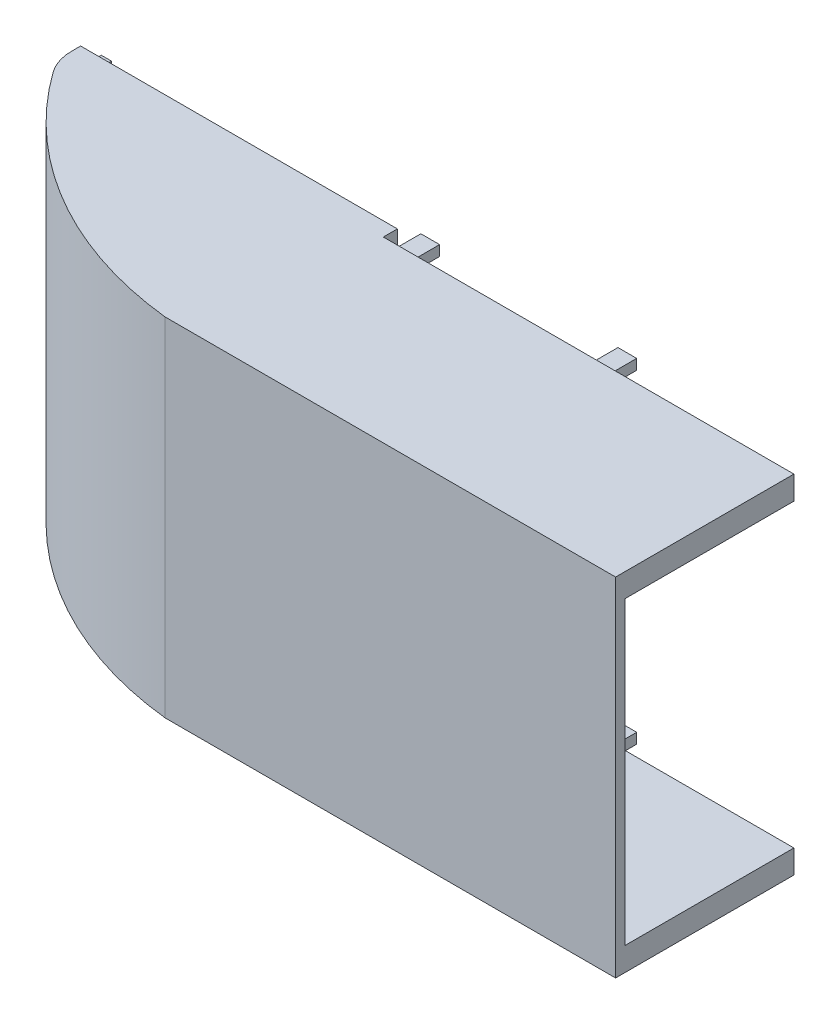
from build123d import *

# Parameters (mm, degrees)
CROQUIS1_W              = 118
CROQUIS1_H              = 74
SALIENTE_EXTRUIR1_DEPTH = 36
CROQUIS2_W              = 36
CROQUIS2_H              = 64
CORTAR_EXTRUIR1_DEPTH   = 120
CORTAR_EXTRUIR3_DEPTH   = 102.257098517
SALIENTE_EXTRUIR2_DEPTH = 64
CORTAR_EXTRUIR4_DEPTH   = 9
CORTAR_EXTRUIR5_DEPTH   = 9
SALIENTE_EXTRUIR4_DEPTH = 5
CROQUIS14_W             = 50.5
CROQUIS14_H             = 3
CORTAR_EXTRUIR7_DEPTH   = 74
CROQUIS15_W             = 4
CROQUIS15_H             = 2.2
CROQUIS15_W_2           = 2.2
CROQUIS15_H_2           = 4
SALIENTE_EXTRUIR3_DEPTH = 6
REDONDEO1_R             = 10
SALIENTE_EXTRUIR5_DEPTH = 37
CROQUIS21_W             = 8
CROQUIS21_H             = 35
SALIENTE_EXTRUIR6_DEPTH = 5
CROQUIS22_W             = 2.9
CROQUIS22_H             = 35
CORTAR_EXTRUIR8_DEPTH   = 5
CROQUIS23_W             = 3.8
CROQUIS23_H             = 35
SALIENTE_EXTRUIR7_DEPTH = 1.9


with BuildPart() as part:
    # Croquis1 → Saliente-Extruir1 (new body)
    with BuildSketch(Plane.XY):
        Rectangle(CROQUIS1_W, CROQUIS1_H)
    extrude(amount=SALIENTE_EXTRUIR1_DEPTH)

    # Croquis2 → Cortar-Extruir1 (cut)
    with BuildSketch(Plane(origin=(59, 0, 0), x_dir=(0, 0, -1), z_dir=(1, 0, 0))):
        with Locations((-18, 0)):
            Rectangle(CROQUIS2_W, CROQUIS2_H)
    extrude(amount=-CORTAR_EXTRUIR1_DEPTH, mode=Mode.SUBTRACT)


with BuildPart() as cortar_extruir1_piece_1:
    # of the separate pieces the step leaves, piece 1, a body of its own (cortar_extruir1_pieces)
    add(part.part.solids().sort_by_distance((-59, 37, 0))[0])


with BuildPart() as cortar_extruir1_piece_2:
    # of the separate pieces the step leaves, piece 2, a body of its own (cortar_extruir1_pieces)
    add(part.part.solids().sort_by_distance((-59, -37, 0))[0])


with BuildPart() as cortar_extruir3_tool:
    # Croquis6 → Cortar-Extruir3 (new, through all)
    with BuildSketch(Plane.XZ.offset(37)):
        with BuildLine():
            Line((-59, 0), (-59, 36))
            Line((-59, 36), (0, 36))
            ThreePointArc((0, 36), (-33.535731191, 24.614115008), (-59, 0))
        make_face()
    extrude(amount=-CORTAR_EXTRUIR3_DEPTH)


with BuildPart() as cortar_extruir1_piece_1_1:
    add(cortar_extruir1_piece_1.part)

    # Cortar-Extruir3: cut by cortar_extruir3_tool
    add(cortar_extruir3_tool.part, mode=Mode.SUBTRACT)



with BuildPart() as cortar_extruir1_piece_2_1:
    add(cortar_extruir1_piece_2.part)

    # Cortar-Extruir3: cut by cortar_extruir3_tool
    add(cortar_extruir3_tool.part, mode=Mode.SUBTRACT)


with BuildPart() as cortar_extruir1_piece_1_2:
    add(cortar_extruir1_piece_1_1.part)

    add(cortar_extruir1_piece_2_1.part)  # Saliente-Extruir2 merges Cortar-Extruir1 piece 2
    # Croquis7 → Saliente-Extruir2 (add)
    with BuildSketch(Plane.XZ.offset(-32)):
        with BuildLine():
            Line((0, 36), (59, 36))
            Line((59, 36), (59, 34))
            Line((59, 34), (14, 34))
            Line((14, 34), (-54, 6))
            Line((-54, 6), (-54, 0))
            Line((-54, 0), (-59, 0))
            ThreePointArc((-59, 0), (-33.535731191, 24.614115008), (0, 36))
        make_face()
    extrude(amount=SALIENTE_EXTRUIR2_DEPTH)

    # Croquis8 → Cortar-Extruir4 (cut)
    with BuildSketch(Plane.XZ.offset(-32)):
        with BuildLine():
            Line((14, 34), (-46.937159353, 8.908228502))
            ThreePointArc((-46.937159353, 8.908228502), (-19.288572578, 28.30266844), (14, 34))
        make_face()
    extrude(amount=CORTAR_EXTRUIR4_DEPTH, mode=Mode.SUBTRACT)

    # Croquis13 → Cortar-Extruir5 (cut)
    with BuildSketch(Plane(origin=(0, -32, 0), x_dir=(1, 0, 0), z_dir=(0, 1, 0))):
        with BuildLine():
            Line((14, -34), (-46.936286689, -8.908587834))
            ThreePointArc((-46.936286689, -8.908587834), (-19.28805118, -28.302641518), (14, -34))
        make_face()
    extrude(amount=CORTAR_EXTRUIR5_DEPTH, mode=Mode.SUBTRACT)

    # Croquis17 → Saliente-Extruir4 (add)
    with BuildSketch(Plane(origin=(0, 0, 0), x_dir=(-1, 0, 0), z_dir=(0, 0, -1))):
        Polygon((-59, 37), (-59, 32), (54, 32), (54, -32), (-59, -32), (-59, -37), (59, -37), (59, 37), align=None)
    extrude(amount=SALIENTE_EXTRUIR4_DEPTH)

    # Croquis14 → Cortar-Extruir7 (cut)
    with BuildSketch(Plane.XZ.offset(37)):
        with Locations((33.75, -3.5)):
            Rectangle(CROQUIS14_W, CROQUIS14_H)
    extrude(amount=-CORTAR_EXTRUIR7_DEPTH, mode=Mode.SUBTRACT)

    # Croquis15 → Saliente-Extruir3 (add)
    with BuildSketch(Plane(origin=(0, 0, -2), x_dir=(-1, 0, 0), z_dir=(0, 0, -1))):
        with Locations((-54.5, 34.5)):
            Rectangle(CROQUIS15_W, CROQUIS15_H)
        with Locations((-54.5, -34.5)):
            Rectangle(CROQUIS15_W, CROQUIS15_H)
        with Locations((-12.5, 34.5)):
            Rectangle(CROQUIS15_W, CROQUIS15_H)
        with Locations((-12.5, -34.5)):
            Rectangle(CROQUIS15_W, CROQUIS15_H)
        with Locations((56.5, -32.5)):
            Rectangle(CROQUIS15_W_2, CROQUIS15_H_2)
        with Locations((56.5, 32.5)):
            Rectangle(CROQUIS15_W_2, CROQUIS15_H_2)
    extrude(amount=SALIENTE_EXTRUIR3_DEPTH)

    # Redondeo1
    redondeo1_edges = [cortar_extruir1_piece_1_2.edges().sort_by_distance(p)[0] for p in [
        (-59, 0, 0),
    ]]
    fillet(redondeo1_edges, radius=REDONDEO1_R)

    # Croquis19 → Saliente-Extruir5 (add)
    with BuildSketch(Plane(origin=(59, 0, 0), x_dir=(0, 0, -1), z_dir=(1, 0, 0))):
        Polygon((2, 37), (2, 32), (-34, 32), (-34, -32), (2, -32), (2, -37), (-36, -37), (-36, 37), align=None)
    extrude(amount=SALIENTE_EXTRUIR5_DEPTH)

    # Croquis21 → Saliente-Extruir6 (add)
    with BuildSketch(Plane(origin=(-54, 0, 0), x_dir=(0, 0, -1), z_dir=(1, 0, 0))):
        with Locations((1, 0.003682439)):
            Rectangle(CROQUIS21_W, CROQUIS21_H)
    extrude(amount=SALIENTE_EXTRUIR6_DEPTH)

    # Croquis22 → Cortar-Extruir8 (cut)
    with BuildSketch(Plane(origin=(-49, 0, 0), x_dir=(0, 0, -1), z_dir=(1, 0, 0))):
        with Locations((3.55, 0.003682439)):
            Rectangle(CROQUIS22_W, CROQUIS22_H)
    extrude(amount=-CORTAR_EXTRUIR8_DEPTH, mode=Mode.SUBTRACT)

    # Croquis23 → Saliente-Extruir7 (add)
    with BuildSketch(Plane(origin=(-54, 0, 0), x_dir=(0, 0, -1), z_dir=(1, 0, 0))):
        with Locations((-4.9, 0.003682439)):
            Rectangle(CROQUIS23_W, CROQUIS23_H)
    extrude(amount=SALIENTE_EXTRUIR7_DEPTH)


solid = cortar_extruir1_piece_1_2.part
